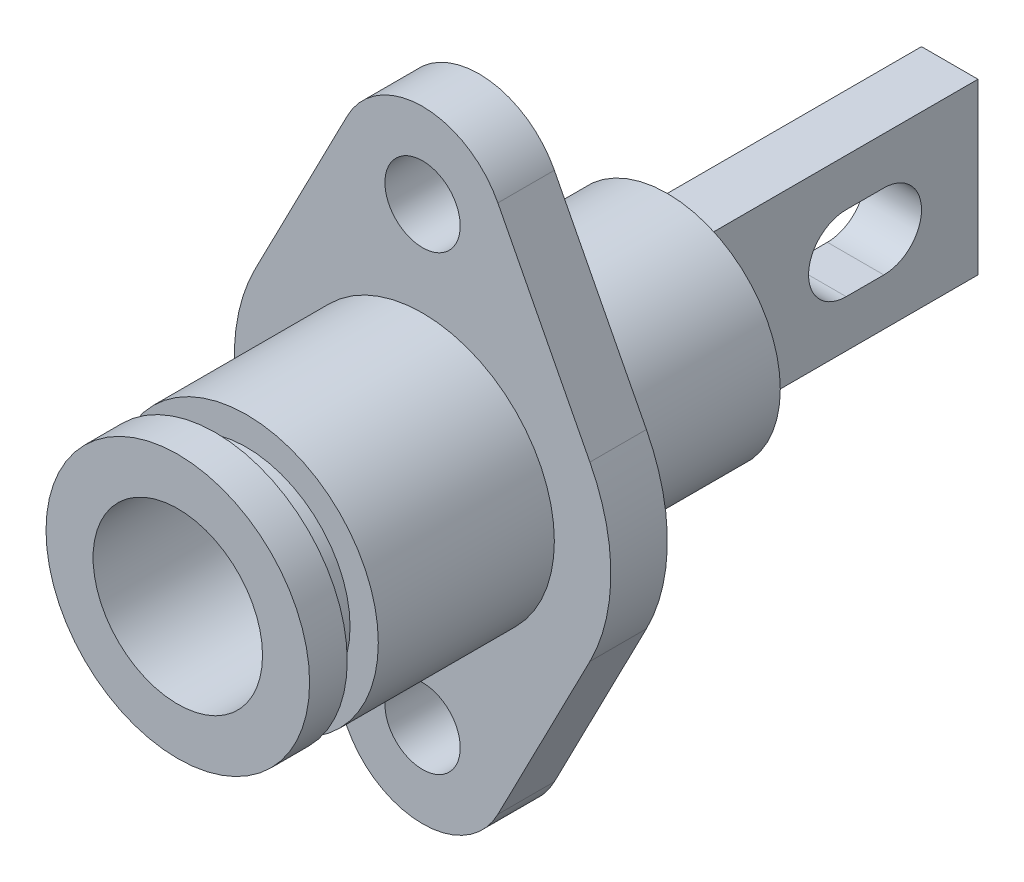
from build123d import *

# Parameters (mm, degrees)
SKETCH1_R           = 2
BOSS_EXTRUDE1_DEPTH = 3
SKETCH2_R           = 7
BOSS_EXTRUDE2_DEPTH = 9.35
SKETCH3_R           = 7.5
BOSS_EXTRUDE3_DEPTH = 0.5
SKETCH4_W           = 3
SKETCH4_H           = 9
BOSS_EXTRUDE4_DEPTH = 24.5
SKETCH5_R           = 6
BOSS_EXTRUDE5_DEPTH = 9.5
SKETCH8_R           = 5.5
BOSS_EXTRUDE6_DEPTH = 1.65
SKETCH9_R           = 7
BOSS_EXTRUDE7_DEPTH = 2
SKETCH10_R          = 4.5
CUT_EXTRUDE1_DEPTH  = 25
CUT_EXTRUDE2_DEPTH  = 3


with BuildPart() as part:
    # Sketch1 → Boss-Extrude1 (new body)
    with BuildSketch(Plane.XY):
        with BuildLine():
            ThreePointArc((-3.999511648, -14.062500079), (-8.7e-08, -16.5), (3.999511568, -14.062500234))
            Line((3.999511568, -14.062500234), (8.887803753, -4.583333333))
            ThreePointArc((8.887803753, -4.583333333), (10, 0), (8.887803753, 4.583333333))
            Line((8.887803753, 4.583333333), (3.999511579, 14.062500214))
            ThreePointArc((3.999511579, 14.062500214), (-6.7e-08, 16.5), (-3.99951164, 14.062500095))
            Line((-3.99951164, 14.062500095), (-8.887803753, 4.583333333))
            ThreePointArc((-8.887803753, 4.583333333), (-10, 0), (-8.887803753, -4.583333333))
            Line((-8.887803753, -4.583333333), (-3.999511648, -14.062500079))
        make_face()
        with Locations((0, -12)):
            Circle(SKETCH1_R, mode=Mode.SUBTRACT)
        with Locations((0, 12)):
            Circle(SKETCH1_R, mode=Mode.SUBTRACT)
    extrude(amount=BOSS_EXTRUDE1_DEPTH)

    # Sketch2 → Boss-Extrude2 (add)
    with BuildSketch(Plane.XY.offset(3)):
        Circle(SKETCH2_R)
    extrude(amount=BOSS_EXTRUDE2_DEPTH)

    # Sketch3 → Boss-Extrude3 (add)
    with BuildSketch(Plane(origin=(0, 0, 0), x_dir=(-1, 0, 0), z_dir=(0, 0, -1))):
        with Locations(Location((0, 0, 0), (0, 0, 180))):
            Circle(SKETCH3_R)
    extrude(amount=BOSS_EXTRUDE3_DEPTH)

    # Sketch4 → Boss-Extrude4 (add)
    with BuildSketch(Plane(origin=(0, 0, -0.5), x_dir=(-1, 0, 0), z_dir=(0, 0, -1))):
        Rectangle(SKETCH4_W, SKETCH4_H)
    extrude(amount=BOSS_EXTRUDE4_DEPTH)

    # Sketch5 → Boss-Extrude5 (add)
    with BuildSketch(Plane(origin=(0, 0, -0.5), x_dir=(-1, 0, 0), z_dir=(0, 0, -1))):
        Circle(SKETCH5_R)
    extrude(amount=BOSS_EXTRUDE5_DEPTH)

    # Sketch8 → Boss-Extrude6 (add)
    with BuildSketch(Plane.XY.offset(12.35)):
        Circle(SKETCH8_R)
    extrude(amount=BOSS_EXTRUDE6_DEPTH)

    # Sketch9 → Boss-Extrude7 (add)
    with BuildSketch(Plane.XY.offset(14)):
        Circle(SKETCH9_R)
    extrude(amount=BOSS_EXTRUDE7_DEPTH)

    # Sketch10 → Cut-Extrude1 (cut)
    with BuildSketch(Plane.XY.offset(16)):
        Circle(SKETCH10_R)
    extrude(amount=-CUT_EXTRUDE1_DEPTH, mode=Mode.SUBTRACT)

    # Sketch15 → Cut-Extrude2 (cut)
    with BuildSketch(Plane(origin=(1.5, 0, 0), x_dir=(0, 0, -1), z_dir=(1, 0, 0))):
        with BuildLine():
            Line((20, -2), (18, -2))
            ThreePointArc((18, -2), (16, 0), (18, 2))
            Line((18, 2), (20, 2))
            ThreePointArc((20, 2), (22, 0), (20, -2))
        make_face()
    extrude(amount=-CUT_EXTRUDE2_DEPTH, mode=Mode.SUBTRACT)


solid = part.part
